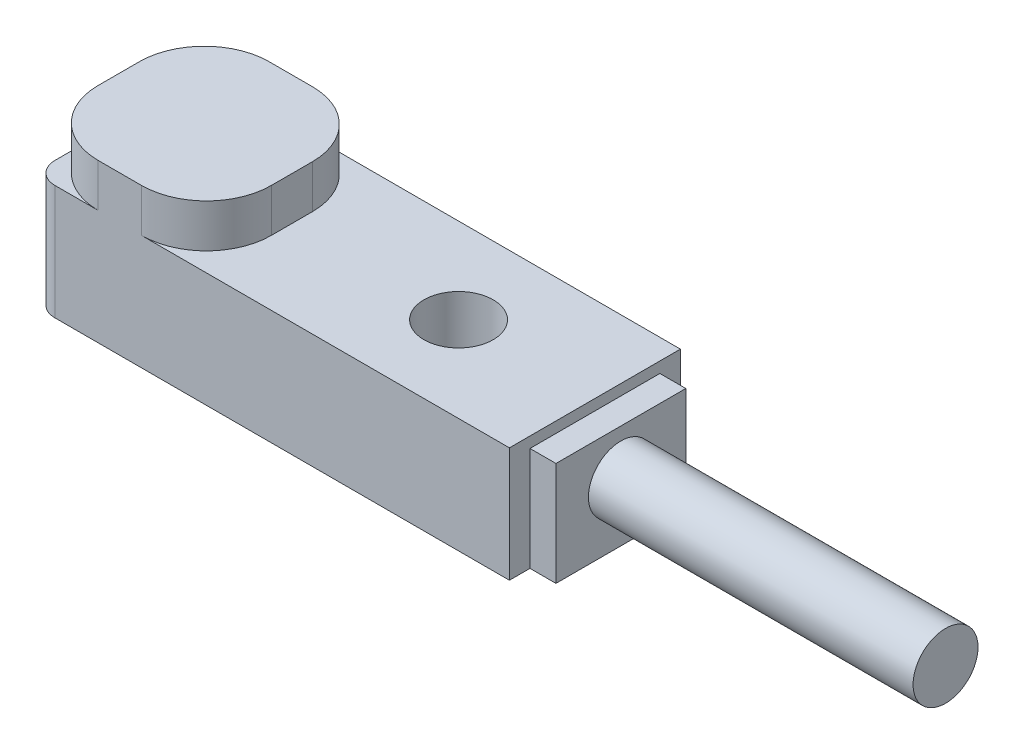
from build123d import *

# Parameters (mm, degrees)
ESQUISSE1_W             = 14
ESQUISSE1_H             = 7.9
ESQUISSE1_W_2           = 8
BOSS_EXTRU_1_DEPTH      = 5.3
ESQUISSE1_4_W           = 8
ESQUISSE1_4_H           = 7.9
BOSS_EXTRU_2_DEPTH      = 7.3
ESQUISSE2_OUTSIDE_W     = 28.898
ESQUISSE2_OUTSIDE_H     = 14.798
ENL_V_MAT_EXTRU_2_DEPTH = 2
D_GAGEMENT_M31_D        = 3.2
CONG_1_R                = 1
ESQUISSE5_W             = 6
ESQUISSE5_H             = 4.8
BOSS_EXTRU_3_DEPTH      = 1.2
ESQUISSE6_R             = 1.5
BOSS_EXTRU_4_DEPTH      = 15


with BuildPart() as part:
    # Esquisse1 → Boss.-Extru.1 (new body)
    with BuildSketch(Plane(origin=(0, 0, 0), x_dir=(1, 0, 0), z_dir=(0, 1, 0))):
        with Locations((11, 0)):
            Rectangle(ESQUISSE1_W, ESQUISSE1_H)
        Rectangle(ESQUISSE1_W_2, ESQUISSE1_H)
    extrude(amount=BOSS_EXTRU_1_DEPTH)

    # Esquisse1<4> → Boss.-Extru.2 (add)
    with BuildSketch(Plane(origin=(0, 0, 0), x_dir=(1, 0, 0), z_dir=(0, 1, 0))):
        Rectangle(ESQUISSE1_4_W, ESQUISSE1_4_H)
    extrude(amount=BOSS_EXTRU_2_DEPTH)

    # Esquisse2 outside → Enlèv. mat.-Extru.2 (cut)
    with BuildSketch(Plane(origin=(0, 7.3, 0), x_dir=(1, 0, 0), z_dir=(0, 1, 0))):
        with Locations((7, 0)):
            Rectangle(ESQUISSE2_OUTSIDE_W, ESQUISSE2_OUTSIDE_H)
        with BuildLine():
            Line((4, -0.95), (4, 0.95))
            ThreePointArc((4, 0.95), (3.121320344, 3.071320344), (1, 3.95))
            Line((1, 3.95), (-1, 3.95))
            ThreePointArc((-1, 3.95), (-3.121320344, 3.071320344), (-4, 0.95))
            Line((-4, 0.95), (-4, -0.95))
            ThreePointArc((-4, -0.95), (-3.121320344, -3.071320344), (-1, -3.95))
            Line((-1, -3.95), (1, -3.95))
            ThreePointArc((1, -3.95), (3.121320344, -3.071320344), (4, -0.95))
        make_face(mode=Mode.SUBTRACT)
    extrude(amount=-ENL_V_MAT_EXTRU_2_DEPTH, mode=Mode.SUBTRACT)

    # Dégagement M31 (through all)
    with Locations(Plane(origin=(0, 5.3, 0), x_dir=(1, 0, 0), z_dir=(0, 1, 0))):
        with Locations((11.7, 0)):
            Hole(D_GAGEMENT_M31_D / 2)

    # Congé1
    cong_1_edges = [part.edges().sort_by_distance(p)[0] for p in [
        (-4, 2.65, 3.95),
        (-4, 2.65, -3.95),
    ]]
    fillet(cong_1_edges, radius=CONG_1_R)

    # Esquisse5 → Boss.-Extru.3 (add)
    with BuildSketch(Plane(origin=(18, 0, 0), x_dir=(0, 0, -1), z_dir=(1, 0, 0))):
        with Locations((0, 2.4)):
            Rectangle(ESQUISSE5_W, ESQUISSE5_H)
    extrude(amount=BOSS_EXTRU_3_DEPTH)

    # Esquisse6 → Boss.-Extru.4 (add)
    with BuildSketch(Plane(origin=(19.2, 0, 0), x_dir=(0, 0, -1), z_dir=(1, 0, 0))):
        with Locations((0, 2.7)):
            Circle(ESQUISSE6_R)
    extrude(amount=BOSS_EXTRU_4_DEPTH)


solid = part.part
